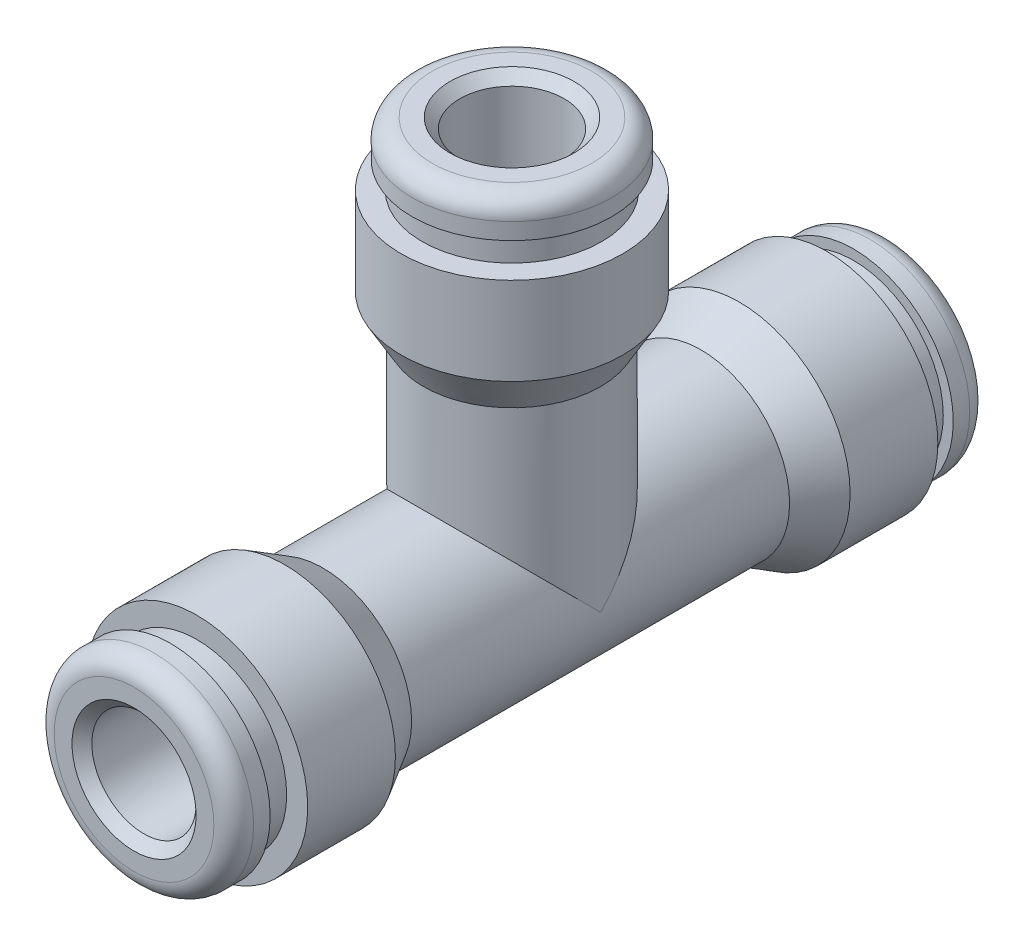
from build123d import *

# Parameters (mm, degrees)
CIRPATTERN1_COUNT   = 3
CIRPATTERN1_ANGLE   = 180
SKETCH3_R           = 3.4
BOSS_EXTRUDE1_DEPTH = 0.25
CIRPATTERN2_COUNT   = 2
CIRPATTERN2_ANGLE   = 180


with BuildPart() as part:
    # Sketch1 → Revolve1 (revolve)
    with BuildSketch(Plane(origin=(0, 0, 0), x_dir=(0, 0, -1), z_dir=(1, 0, 0)), mode=Mode.PRIVATE) as revolve1_sk:
        with BuildLine():
            Line((13.103, 3.825), (13.738, 3.825))
            ThreePointArc((13.738, 3.825), (14.276815367, 3.601815367), (14.5, 3.063))
            Line((14.5, 3.063), (14.5, 2.381))
            Line((14.5, 2.381), (14.119, 2))
            Line((14.119, 2), (4.35, 2))
            Line((4.35, 2), (4.35, 1.238))
            Line((4.35, 1.238), (0, 1.238))
            Line((0, 1.238), (0, 3.4))
            Line((0, 3.4), (7.25, 3.4))
            Line((7.25, 3.4), (8.722243186, 4.25))
            Line((8.722243186, 4.25), (12.087, 4.25))
            Line((12.087, 4.25), (12.087, 3.4425))
            Line((12.087, 3.4425), (13.103, 3.4425))
            Line((13.103, 3.4425), (13.103, 3.825))
        make_face()
    revolve(revolve1_sk.sketch.rotate(Axis((0, 0, 0), (0, 0, -1)), 90), axis=Axis((0, 0, 0), (0, 0, -1)))


with BuildPart() as cirpattern1_1:
    # CirPattern1: pattern copy
    add(part.part.rotate(Axis((0, 0, 0), (1, 0, 0)), 1 * CIRPATTERN1_ANGLE / (CIRPATTERN1_COUNT - 1)))


with BuildPart() as cirpattern1_2:
    # CirPattern1: pattern copy
    add(part.part.rotate(Axis((0, 0, 0), (1, 0, 0)), 2 * CIRPATTERN1_ANGLE / (CIRPATTERN1_COUNT - 1)))


with BuildPart() as cirpattern1_1_1:
    # Body-Move/Copy1: moved
    add(cirpattern1_1.part.moved(Location((0, 0.25, 0))))

    # Sketch3 → Boss-Extrude1 (add)
    with BuildSketch(Plane(origin=(0, 0, 0), x_dir=(1, 0, 0), z_dir=(0, 1, 0))):
        Circle(SKETCH3_R)
    extrude(amount=BOSS_EXTRUDE1_DEPTH)


with BuildPart() as cut_revolve2_tool:
    # Sketch4 → Cut-Revolve2 (revolve)
    with BuildSketch(Plane(origin=(0, 0, 0), x_dir=(0, 0, -1), z_dir=(1, 0, 0))):
        Polygon((2, 14.369), (2.381, 14.75), (0, 14.75), (0, 0), (1.238, 0), (1.238, 4.6), (2, 4.6), align=None)
    revolve(axis=Axis((0, 0, 0), (0, 1, 0)))


with BuildPart() as part_1:
    add(part.part)

    # Cut-Revolve2: cut by cut_revolve2_tool
    add(cut_revolve2_tool.part, mode=Mode.SUBTRACT)


with BuildPart() as cirpattern1_1_2:
    add(cirpattern1_1_1.part)

    # Cut-Revolve2: cut by cut_revolve2_tool
    add(cut_revolve2_tool.part, mode=Mode.SUBTRACT)


with BuildPart() as cirpattern1_2_1:
    add(cirpattern1_2.part)

    # Cut-Revolve2: cut by cut_revolve2_tool
    add(cut_revolve2_tool.part, mode=Mode.SUBTRACT)


with BuildPart() as part_2:
    add(part_1.part)

    # Combine1: union CirPattern1_1, CirPattern1_2
    add(cirpattern1_1_2.part)
    add(cirpattern1_2_1.part)

    # Sketch5 → Cut-Revolve1 (revolve, cut)
    with BuildSketch(Plane(origin=(0, 0, 0), x_dir=(0, 0, -1), z_dir=(1, 0, 0)), mode=Mode.PRIVATE) as cut_revolve1_sk:
        Polygon((14.5, 2.381), (14.119, 2), (4.35, 2), (4.35, 1.238), (0, 1.238), (0, 0), (14.5, 0), align=None)
    cut_revolve1 = revolve(cut_revolve1_sk.sketch.rotate(Axis((0, 0, 0), (0, 0, -1)), 90), axis=Axis((0, 0, 0), (0, 0, -1)), mode=Mode.SUBTRACT)

    # CirPattern2: Cut-Revolve1 ×2 about axis
    cirpattern2_axis = Axis((-6.05, 0, 0), (1, 0, 0))
    for i in range(1, CIRPATTERN2_COUNT):
        add(cut_revolve1.rotate(cirpattern2_axis, i * CIRPATTERN2_ANGLE / (CIRPATTERN2_COUNT - 1)), mode=Mode.SUBTRACT)


solid = part_2.part
